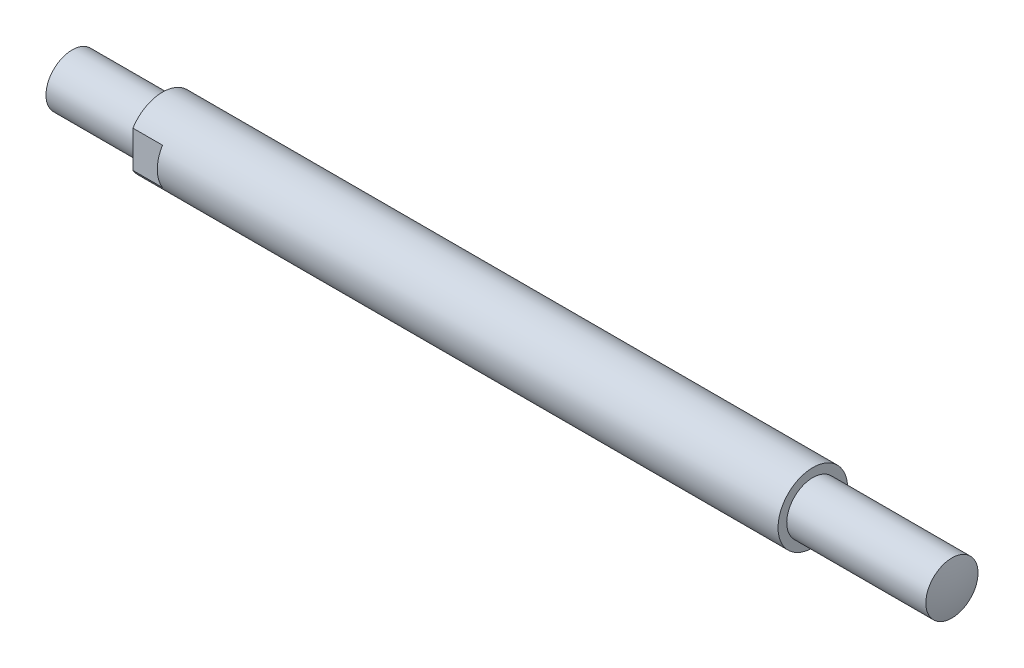
from build123d import *

# Parameters (mm, degrees)
SKETCH2_W          = 13.807149041
SKETCH2_H          = 34.00821274
SKETCH2_W_2        = 8.154557823
SKETCH2_H_2        = 39.290142239
CUT_EXTRUDE1_DEPTH = 17


with BuildPart() as part:
    # Sketch1 → Revolve1 (revolve)
    with BuildSketch(Plane.XY, mode=Mode.PRIVATE) as revolve1_sk:
        with BuildLine():
            Line((-239, 15), (-187, 15))
            Line((-187, 15), (-187, 20))
            Line((-187, 20), (187, 20))
            Line((187, 20), (187, 15))
            Line((187, 15), (267, 15))
            ThreePointArc((267, 15), (268.497797314, 7.566372975), (269, 0))
            Line((269, 0), (-241, 0))
            ThreePointArc((-241, 0), (-240.497797314, 7.566372975), (-239, 15))
        make_face()
    revolve(revolve1_sk.sketch.rotate(Axis((-241, 0, 0), (1, 0, 0)), 180), axis=Axis((-241, 0, 0), (1, 0, 0)))

    # Sketch2 → Cut-Extrude1 (cut)
    with BuildSketch(Plane.ZY.offset(187)):
        with Locations((23.903574521, 0.880321583)):
            Rectangle(SKETCH2_W, SKETCH2_H)
        with Locations((-21.077278912, -2.316635745)):
            Rectangle(SKETCH2_W_2, SKETCH2_H_2)
    extrude(amount=-CUT_EXTRUDE1_DEPTH, mode=Mode.SUBTRACT)


solid = part.part
